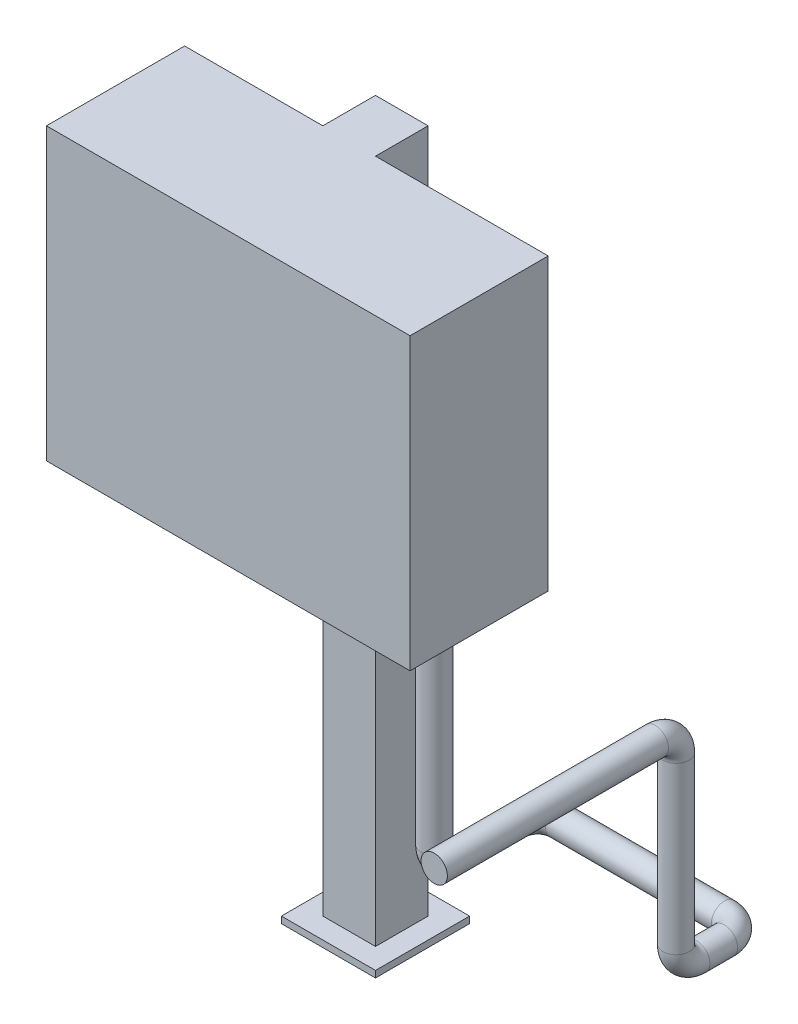
from build123d import *

# Parameters (mm, degrees)
CROQUIS1_W              = 76.2
CROQUIS1_H              = 1000
SALIENTE_EXTRUIR1_DEPTH = 76.2
CROQUIS2_W              = 136.2
CROQUIS2_H              = 136.2
SALIENTE_EXTRUIR2_DEPTH = 9.525
CROQUIS3_W              = 526.2
CROQUIS3_H              = 420
SALIENTE_EXTRUIR3_DEPTH = 200
CROQUIS4_R              = 19.05
SALIENTE_EXTRUIR4_DEPTH = 30
CROQUIS5_R              = 19.05


with BuildPart() as part:
    # Croquis1 → Saliente-Extruir1 (new body)
    with BuildSketch(Plane.XY):
        with Locations((38.1, 500)):
            Rectangle(CROQUIS1_W, CROQUIS1_H)
    extrude(amount=SALIENTE_EXTRUIR1_DEPTH)

    # Croquis2 → Saliente-Extruir2 (add)
    with BuildSketch(Plane.XZ):
        with Locations((38.1, 38.1)):
            Rectangle(CROQUIS2_W, CROQUIS2_H)
    extrude(amount=-SALIENTE_EXTRUIR2_DEPTH)

    # Croquis3 → Saliente-Extruir3 (add)
    with BuildSketch(Plane.XY.offset(76.2)):
        with Locations((63.1, 790)):
            Rectangle(CROQUIS3_W, CROQUIS3_H)
    extrude(amount=SALIENTE_EXTRUIR3_DEPTH)

    # Croquis4 → Saliente-Extruir4 (add)
    with BuildSketch(Plane.XZ.offset(-580)):
        with Locations(Location((261.2, 176.2, 0), (0, 0, 90))):
            Circle(CROQUIS4_R)
    extrude(amount=SALIENTE_EXTRUIR4_DEPTH)

    # Barrer1: sweep along a curve in space
    with BuildLine() as barrer1_path:
        Line((261.2, 550, 176.2), (261.2, 280, 176.2))
        ThreePointArc((261.2, 280, 176.2), (261.2, 258.786796564, 167.413203436), (261.2, 250, 146.2))
        Line((261.2, 250, 146.2), (261.2, 250, 56.2))
        ThreePointArc((261.2, 250, 56.2), (269.986796564, 250, 34.986796564), (291.2, 250, 26.2))
        Line((291.2, 250, 26.2), (531.2, 250, 26.2))
        ThreePointArc((531.2, 250, 26.2), (552.413203436, 250, 34.986796564), (561.2, 250, 56.2))
        Line((561.2, 250, 56.2), (561.2, 250, 96.2))
        ThreePointArc((561.2, 250, 96.2), (561.2, 258.786796564, 117.413203436), (561.2, 280, 126.2))
        Line((561.2, 280, 126.2), (561.2, 520, 126.2))
        ThreePointArc((561.2, 520, 126.2), (561.2, 541.213203436, 134.986796564), (561.2, 550, 156.2))
        Line((561.2, 550, 156.2), (561.2, 550, 476.2))
    # Croquis5 → Barrer1 (sweep)
    with BuildSketch(Plane.XZ.offset(-550)):
        with Locations((261.2, 176.2)):
            Circle(CROQUIS5_R)
    sweep(path=barrer1_path.line)


solid = part.part
